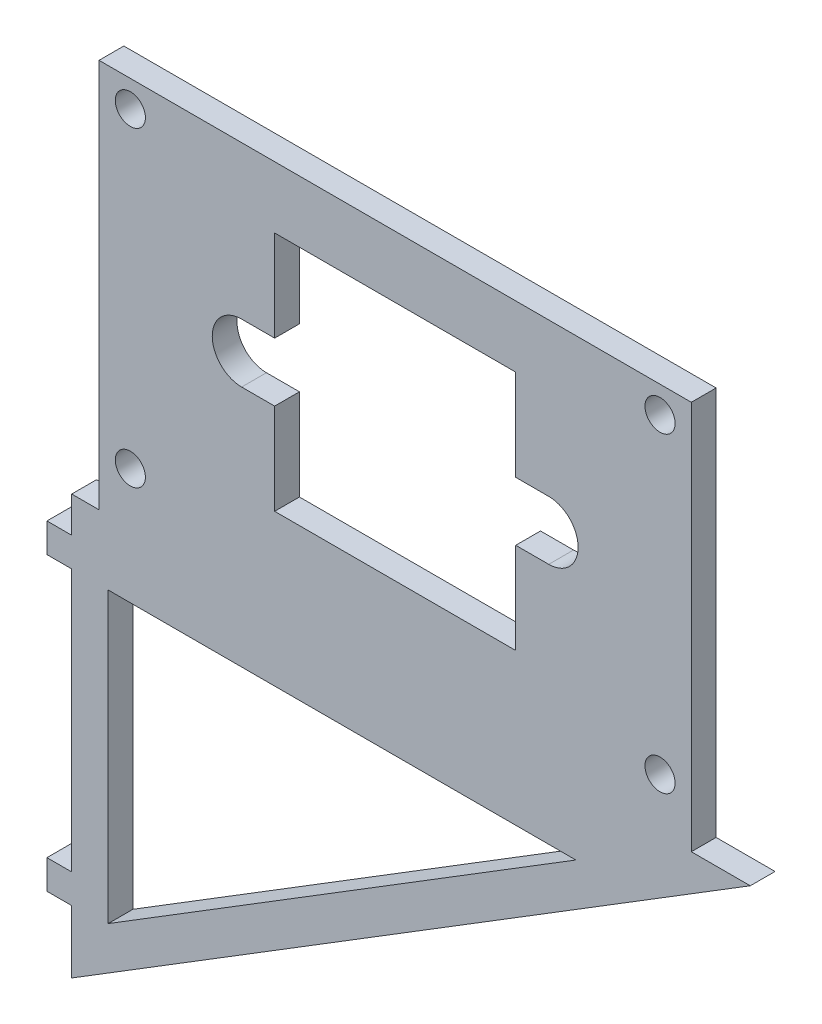
from build123d import *

# Parameters (mm, degrees)
BOSS_EXTRUDE1_DEPTH = 1.7272
SKETCH3_R           = 1.05
CUT_EXTRUDE1_DEPTH  = 1.7272


with BuildPart() as part:
    # Sketch1 → Boss-Extrude1 (new body)
    with BuildSketch(Plane.XY):
        Polygon((0, 0), (47.288728977, 29.21), (43.18, 29.21), (43.18, 56.3372), (1.905, 56.3372), (1.905, 29.21), (0, 29.21), (0, 26.7208), (-1.7272, 26.7208), (-1.7272, 24.6888), (0, 24.6888), (0, 6.4008), (-1.7272, 6.4008), (-1.7272, 4.3688), (0, 4.3688), align=None)
        Polygon((2.54, 24.6888), (35.135968928, 24.6888), (2.54, 4.554440863), align=None, mode=Mode.SUBTRACT)
        with BuildLine():
            Line((14.1425, 41.5872), (14.1425, 35.2372))
            Line((14.1425, 35.2372), (30.9425, 35.2372))
            Line((30.9425, 35.2372), (30.9425, 41.5872))
            Line((30.9425, 41.5872), (33.2425, 41.5872))
            ThreePointArc((33.2425, 41.5872), (35.2925, 43.6372), (33.2425, 45.6872))
            Line((33.2425, 45.6872), (30.9425, 45.6872))
            Line((30.9425, 45.6872), (30.9425, 52.0372))
            Line((30.9425, 52.0372), (14.1425, 52.0372))
            Line((14.1425, 52.0372), (14.1425, 45.6872))
            Line((14.1425, 45.6872), (11.8425, 45.6872))
            ThreePointArc((11.8425, 45.6872), (9.7925, 43.6372), (11.8425, 41.5872))
            Line((11.8425, 41.5872), (14.1425, 41.5872))
        make_face(mode=Mode.SUBTRACT)
    extrude(amount=BOSS_EXTRUDE1_DEPTH)

    # Sketch3 → Cut-Extrude1 (cut)
    with BuildSketch(Plane(origin=(22.5425, 43.6372, 1.7272), x_dir=(1, 0, 0), z_dir=(0, 0, 1))):
        with Locations((-18.4568, 10.8495)):
            Circle(SKETCH3_R)
        with Locations((-18.4568, -10.8495)):
            Circle(SKETCH3_R)
        with Locations((18.4568, -10.8495)):
            Circle(SKETCH3_R)
        with Locations((18.4568, 10.8495)):
            Circle(SKETCH3_R)
    extrude(amount=-CUT_EXTRUDE1_DEPTH, mode=Mode.SUBTRACT)


solid = part.part
